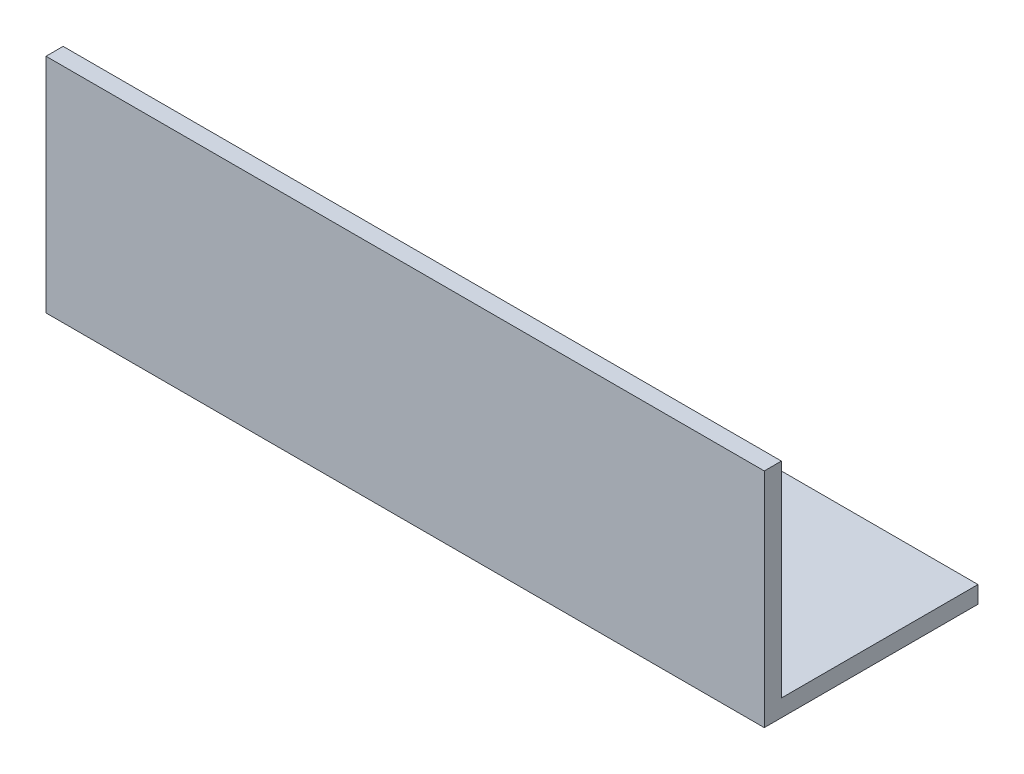
from build123d import *

# Parameters (mm, degrees)
SKETCH1_W           = 66.68
SKETCH1_H           = 1.59
BOSS_EXTRUDE1_DEPTH = 20.64
SKETCH1_3_W         = 66.68
SKETCH1_3_H         = 19.84
SKETCH1_3_R         = 3.175
BOSS_EXTRUDE2_DEPTH = 1.59


with BuildPart() as part:
    # Sketch1 → Boss-Extrude1 (new body)
    with BuildSketch(Plane(origin=(0, 0, 0), x_dir=(1, 0, 0), z_dir=(0, 1, 0))):
        with Locations((0, 0.005)):
            Rectangle(SKETCH1_W, SKETCH1_H)
    extrude(amount=BOSS_EXTRUDE1_DEPTH)

    # Sketch1<3> → Boss-Extrude2 (add)
    with BuildSketch(Plane(origin=(0, 0, 0), x_dir=(1, 0, 0), z_dir=(0, 1, 0))):
        with Locations((0, 9.13)):
            Rectangle(SKETCH1_3_W, SKETCH1_3_H)
        with Locations((13.825, 10.08)):
            Circle(SKETCH1_3_R, mode=Mode.SUBTRACT)
        with Locations((-13.825, 10.08)):
            Circle(SKETCH1_3_R, mode=Mode.SUBTRACT)
    extrude(amount=BOSS_EXTRUDE2_DEPTH)


solid = part.part
